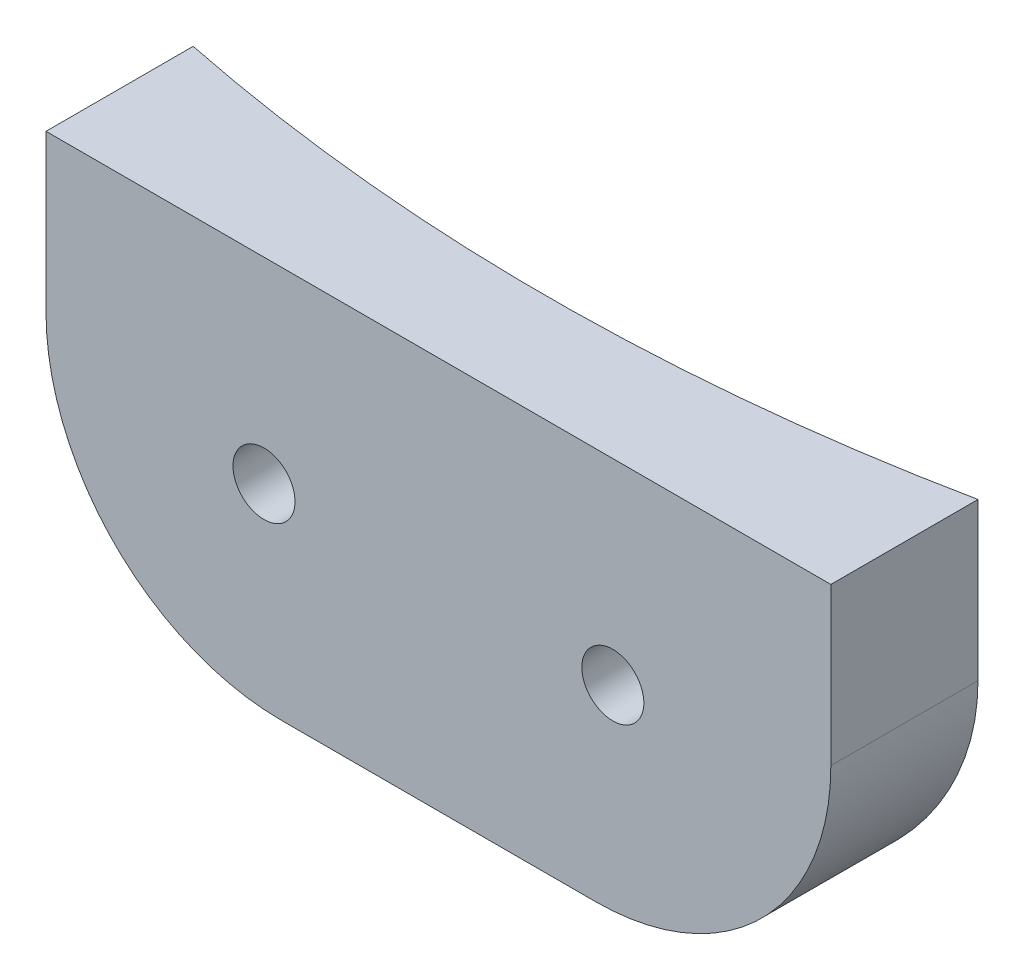
from build123d import *

# Parameters (mm, degrees)
BOSS_EXTRUDE1_DEPTH = 12.7
SKETCH2_R           = 1.0033
CUT_EXTRUDE1_DEPTH  = 66.979539467
FILLET1_R           = 7.62


with BuildPart() as part:
    # Sketch1 → Boss-Extrude1 (new body)
    with BuildSketch(Plane(origin=(0, 0, 0), x_dir=(1, 0, 0), z_dir=(0, 1, 0))):
        with BuildLine():
            ThreePointArc((12.7, -62.217039467), (0, -63.5), (-12.7, -62.217039467))
            Line((-12.7, -62.217039467), (-12.7, -66.979539467))
            Line((-12.7, -66.979539467), (12.7, -66.979539467))
            Line((12.7, -66.979539467), (12.7, -62.217039467))
        make_face()
    extrude(amount=BOSS_EXTRUDE1_DEPTH)

    # Sketch2 → Cut-Extrude1 (cut)
    with BuildSketch(Plane.XY):
        with Locations(Location((-5.644444444, 6.35, 0), (0, 0, 180))):
            Circle(SKETCH2_R)
    cut_extrude1 = extrude(amount=CUT_EXTRUDE1_DEPTH, mode=Mode.SUBTRACT)

    # Mirror1: Cut-Extrude1 across plane
    add(cut_extrude1.mirror(Plane(origin=(0, 0, 0), x_dir=(0, 0, 1), z_dir=(1, 0, 0))), mode=Mode.SUBTRACT)

    # Fillet1
    fillet1_edges = [part.edges().sort_by_distance(p)[0] for p in [
        (12.7, 0, 64.598289467),
        (-12.7, 0, 64.598289467),
    ]]
    fillet(fillet1_edges, radius=FILLET1_R)


solid = part.part
